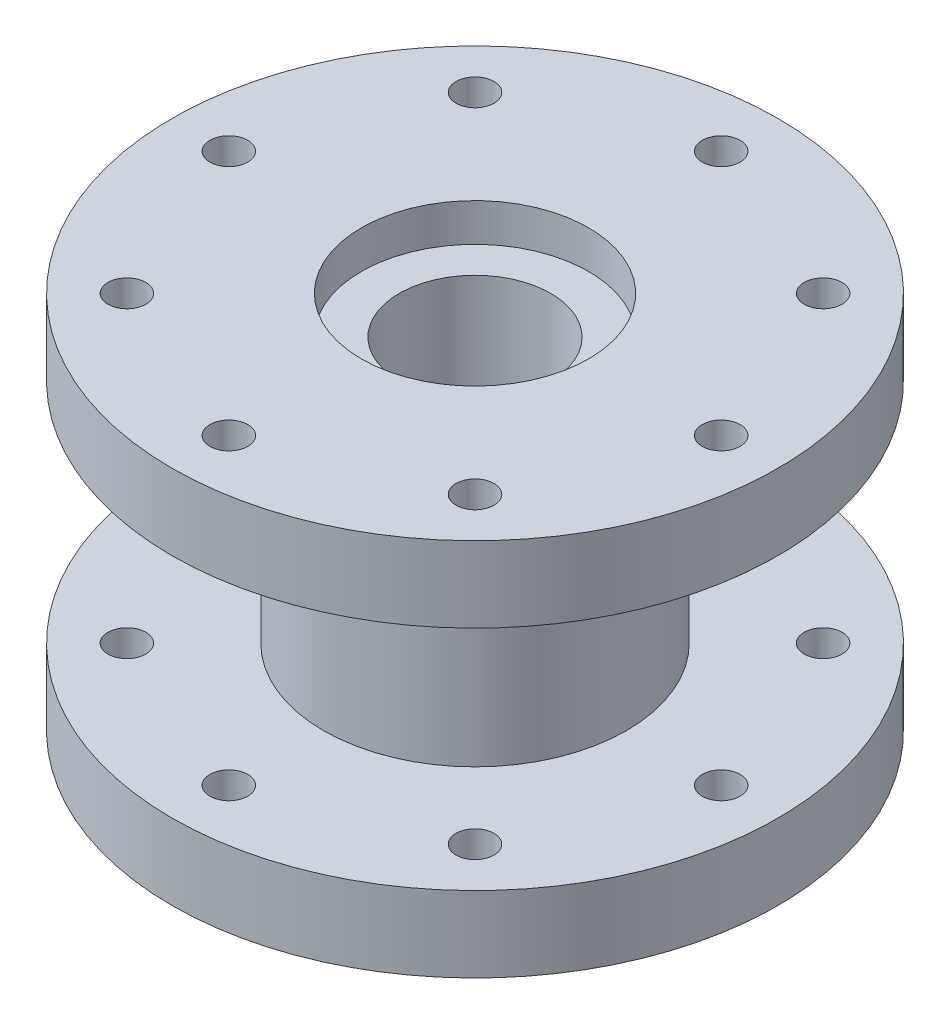
from build123d import *

# Parameters (mm, degrees)
SKETCH2_R          = 3.175
CUT_EXTRUDE2_DEPTH = 96.882897328


with BuildPart() as part:
    # Sketch1 → Revolve1 (revolve)
    with BuildSketch(Plane.XY, mode=Mode.PRIVATE) as revolve1_sk:
        Polygon((12.7, 57.15), (12.7, 6.35), (19.05, 6.35), (19.05, 0), (50.8, 0), (50.8, 12.7), (25.4, 12.7), (25.4, 50.8), (50.8, 50.8), (50.8, 63.5), (19.05, 63.5), (19.05, 57.15), align=None)
    revolve(revolve1_sk.sketch.rotate(Axis((0, 117.328630252, 0), (0, -1, 0)), 90), axis=Axis((0, 117.328630252, 0), (0, -1, 0)))

    # Sketch2 → Cut-Extrude2 (cut, through all)
    with BuildSketch(Plane(origin=(0, 63.5, 0), x_dir=(1, 0, 0), z_dir=(0, 1, 0))):
        with Locations(Location((41.275, 0, 0), (0, 0, 270))):
            Circle(SKETCH2_R)
        with Locations(Location((29.185832393, -29.185832393, 0), (0, 0, 270))):
            Circle(SKETCH2_R)
        with Locations(Location((0, -41.275, 0), (0, 0, 270))):
            Circle(SKETCH2_R)
        with Locations(Location((-29.185832393, -29.185832393, 0), (0, 0, 270))):
            Circle(SKETCH2_R)
        with Locations(Location((-41.275, 0, 0), (0, 0, 270))):
            Circle(SKETCH2_R)
        with Locations(Location((-29.185832393, 29.185832393, 0), (0, 0, 270))):
            Circle(SKETCH2_R)
        with Locations(Location((0, 41.275, 0), (0, 0, 270))):
            Circle(SKETCH2_R)
        with Locations(Location((29.185832393, 29.185832393, 0), (0, 0, 270))):
            Circle(SKETCH2_R)
    extrude(amount=-CUT_EXTRUDE2_DEPTH, mode=Mode.SUBTRACT)


solid = part.part
